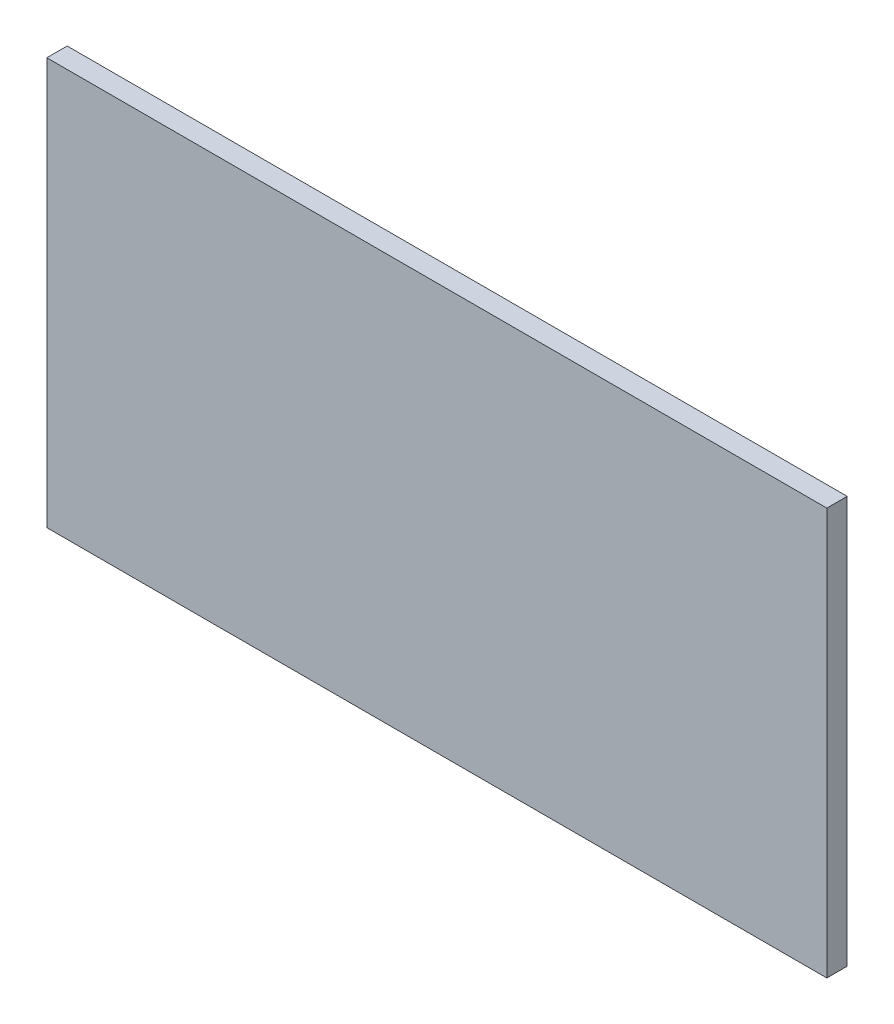
from build123d import *

# Parameters (mm, degrees)
ESBO_O1_W                = 230
ESBO_O1_H                = 120
RESSALTO_EXTRUS_O1_DEPTH = 6


with BuildPart() as part:
    # Esboço1 → Ressalto-extrusão1 (new body)
    with BuildSketch(Plane.XY):
        with Locations((115, -60)):
            Rectangle(ESBO_O1_W, ESBO_O1_H)
    extrude(amount=RESSALTO_EXTRUS_O1_DEPTH)


solid = part.part
